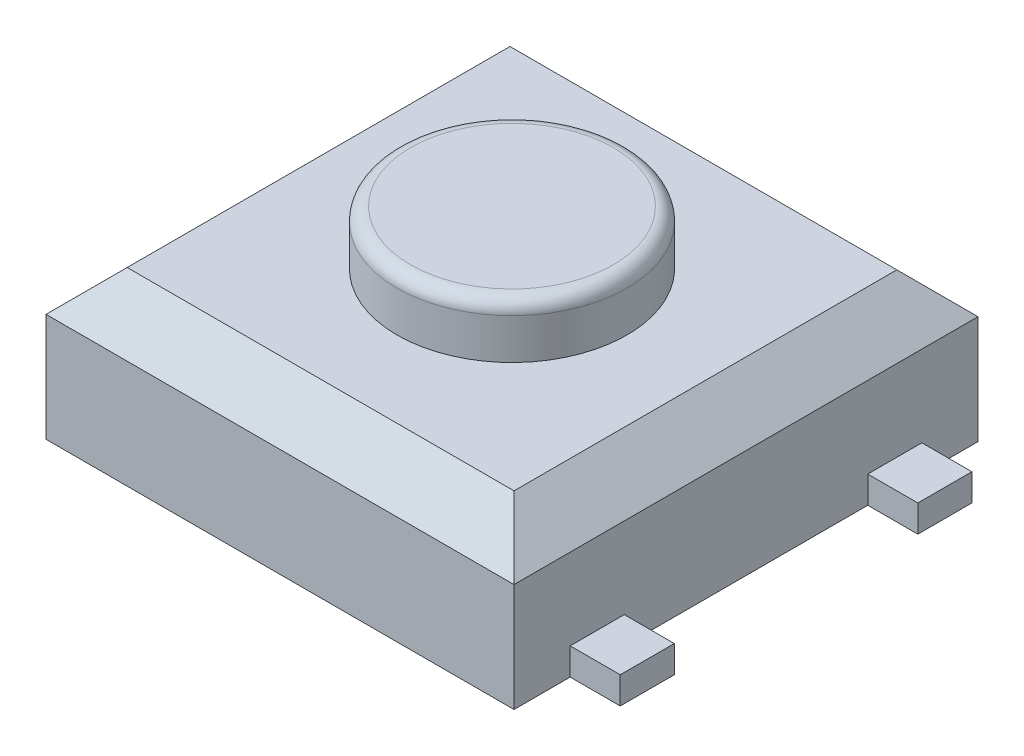
from build123d import *

# Parameters (mm, degrees)
SKETCH1_W           = 3.46
SKETCH1_H           = 3.43
SKETCH1_W_2         = 0.37
SKETCH1_H_2         = 0.4
BOSS_EXTRUDE1_DEPTH = 0.2
SKETCH2_W           = 3.46
SKETCH2_H           = 3.43
BOSS_EXTRUDE2_DEPTH = 0.9
CHAMFER1_SIZE       = 0.3
SKETCH3_R           = 0.85
BOSS_EXTRUDE3_DEPTH = 0.4
FILLET1_R           = 0.1


with BuildPart() as part:
    # Sketch1 → Boss-Extrude1 (new body)
    with BuildSketch(Plane(origin=(0, 0, 0), x_dir=(1, 0, 0), z_dir=(0, 1, 0))):
        Rectangle(SKETCH1_W, SKETCH1_H)
        with Locations((1.915, -1.1)):
            Rectangle(SKETCH1_W_2, SKETCH1_H_2)
        with Locations((-1.915, -1.1)):
            Rectangle(SKETCH1_W_2, SKETCH1_H_2)
        with Locations((-1.915, 1.1)):
            Rectangle(SKETCH1_W_2, SKETCH1_H_2)
        with Locations((1.915, 1.1)):
            Rectangle(SKETCH1_W_2, SKETCH1_H_2)
    extrude(amount=BOSS_EXTRUDE1_DEPTH)

    # Sketch2 → Boss-Extrude2 (add)
    with BuildSketch(Plane(origin=(0, 0.2, 0), x_dir=(1, 0, 0), z_dir=(0, 1, 0))):
        Rectangle(SKETCH2_W, SKETCH2_H)
    extrude(amount=BOSS_EXTRUDE2_DEPTH)

    # Chamfer1
    chamfer1_edges = [part.edges().sort_by_distance(p)[0] for p in [
        (-1.73, 1.1, 0),
        (0, 1.1, 1.715),
        (1.73, 1.1, 0),
        (0, 1.1, -1.715),
    ]]
    chamfer(chamfer1_edges, length=CHAMFER1_SIZE)

    # Sketch3 → Boss-Extrude3 (add)
    with BuildSketch(Plane(origin=(0, 1.1, 0), x_dir=(1, 0, 0), z_dir=(0, 1, 0))):
        with Locations(Location((0, 0, 0), (0, 0, 270))):
            Circle(SKETCH3_R)
    extrude(amount=BOSS_EXTRUDE3_DEPTH)

    # Fillet1
    fillet1_edges = [part.edges().sort_by_distance(p)[0] for p in [
        (0, 1.5, -0.85),
    ]]
    fillet(fillet1_edges, radius=FILLET1_R)


solid = part.part
